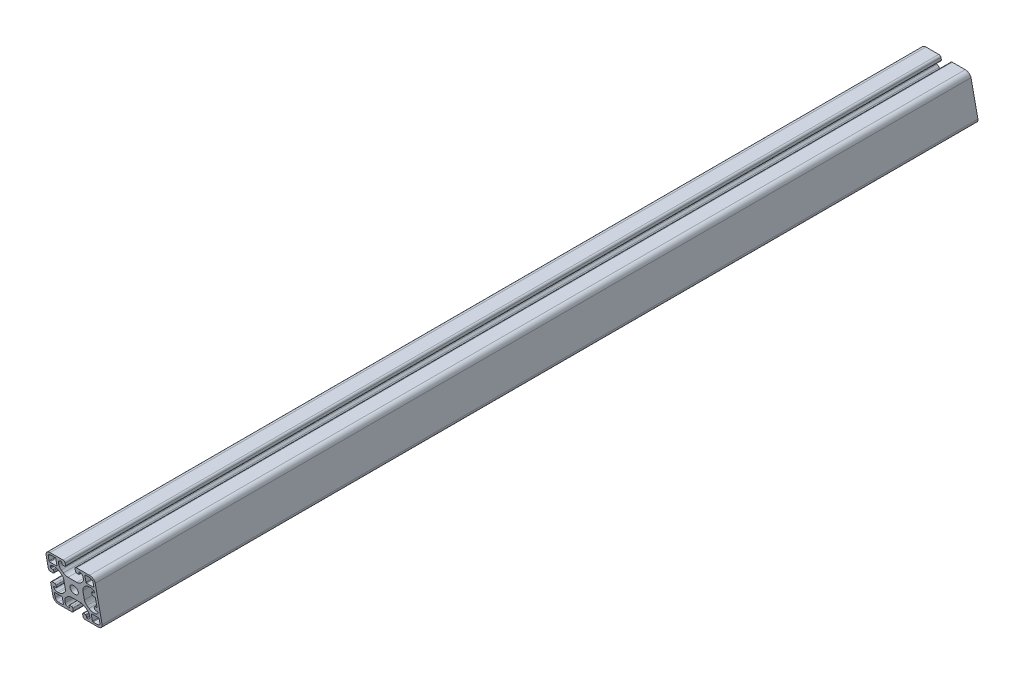
from build123d import *

# Parameters (mm, degrees)
SCHIZZO1_R                   = 3.4
ESTRUSIONE_ESTRUSIONE1_DEPTH = 720
TAGLIO_ESTRUSIONE1_DEPTH     = 383.622529394


with BuildPart() as part:
    # Schizzo1 → Estrusione-Estrusione1 (new body)
    with BuildSketch(Plane(origin=(0, 0, -340), x_dir=(-1, 0, 0), z_dir=(0, 0, -1))):
        with BuildLine():
            Line((6.5, -15.5), (5, -15.5))
            ThreePointArc((5, -15.5), (4.292893219, -15.792893219), (4, -16.5))
            Line((4, -16.5), (4, -18.5))
            ThreePointArc((4, -18.5), (4.439339828, -19.560660172), (5.5, -20))
            Line((5.5, -20), (16, -20))
            ThreePointArc((16, -20), (18.828427125, -18.828427125), (20, -16))
            Line((20, -16), (20, -5.5))
            ThreePointArc((20, -5.5), (19.560660172, -4.439339828), (18.5, -4))
            Line((18.5, -4), (16.5, -4))
            ThreePointArc((16.5, -4), (15.792893219, -4.292893219), (15.5, -5))
            Line((15.5, -5), (15.5, -6.5))
            ThreePointArc((15.5, -6.5), (15.646446609, -6.853553391), (16, -7))
            Line((16, -7), (17.55, -7))
            ThreePointArc((17.55, -7), (17.868198052, -7.131801948), (18, -7.45))
            Line((18, -7.45), (18, -7.5))
            ThreePointArc((18, -7.5), (17.267766953, -9.267766953), (15.5, -10))
            Line((15.5, -10), (14.192388155, -10))
            ThreePointArc((14.192388155, -10), (12.278970994, -9.619397663), (10.656854249, -8.535533906))
            Line((10.656854249, -8.535533906), (9.214466094, -7.09314575))
            ThreePointArc((9.214466094, -7.09314575), (8.130602337, -5.471029006), (7.75, -3.557611845))
            Line((7.75, -3.557611845), (7.75, 3.557611845))
            ThreePointArc((7.75, 3.557611845), (8.130602337, 5.471029006), (9.214466094, 7.09314575))
            Line((9.214466094, 7.09314575), (10.656854249, 8.535533906))
            ThreePointArc((10.656854249, 8.535533906), (12.278970994, 9.619397663), (14.192388155, 10))
            Line((14.192388155, 10), (15.5, 10))
            ThreePointArc((15.5, 10), (17.267766953, 9.267766953), (18, 7.5))
            Line((18, 7.5), (18, 7.45))
            ThreePointArc((18, 7.45), (17.868198052, 7.131801948), (17.55, 7))
            Line((17.55, 7), (16, 7))
            ThreePointArc((16, 7), (15.646446609, 6.853553391), (15.5, 6.5))
            Line((15.5, 6.5), (15.5, 5))
            ThreePointArc((15.5, 5), (15.792893219, 4.292893219), (16.5, 4))
            Line((16.5, 4), (18.5, 4))
            ThreePointArc((18.5, 4), (19.560660172, 4.439339828), (20, 5.5))
            Line((20, 5.5), (20, 16))
            ThreePointArc((20, 16), (18.828427125, 18.828427125), (16, 20))
            Line((16, 20), (5.5, 20))
            ThreePointArc((5.5, 20), (4.439339828, 19.560660172), (4, 18.5))
            Line((4, 18.5), (4, 16.5))
            ThreePointArc((4, 16.5), (4.292893219, 15.792893219), (5, 15.5))
            Line((5, 15.5), (6.5, 15.5))
            ThreePointArc((6.5, 15.5), (6.853553391, 15.646446609), (7, 16))
            Line((7, 16), (7, 17.55))
            ThreePointArc((7, 17.55), (7.131801948, 17.868198052), (7.45, 18))
            Line((7.45, 18), (7.5, 18))
            ThreePointArc((7.5, 18), (9.267766953, 17.267766953), (10, 15.5))
            Line((10, 15.5), (10, 14.192388155))
            ThreePointArc((10, 14.192388155), (9.619397663, 12.278970994), (8.535533906, 10.656854249))
            Line((8.535533906, 10.656854249), (7.09314575, 9.214466094))
            ThreePointArc((7.09314575, 9.214466094), (5.471029006, 8.130602337), (3.557611844, 7.75))
            Line((3.557611844, 7.75), (-3.557611845, 7.75))
            ThreePointArc((-3.557611845, 7.75), (-5.471029006, 8.130602337), (-7.09314575, 9.214466094))
            Line((-7.09314575, 9.214466094), (-8.535533906, 10.656854249))
            ThreePointArc((-8.535533906, 10.656854249), (-9.619397663, 12.278970994), (-10, 14.192388155))
            Line((-10, 14.192388155), (-10, 15.5))
            ThreePointArc((-10, 15.5), (-9.267766953, 17.267766953), (-7.5, 18))
            Line((-7.5, 18), (-7.45, 18))
            ThreePointArc((-7.45, 18), (-7.131801948, 17.868198052), (-7, 17.55))
            Line((-7, 17.55), (-7, 16))
            ThreePointArc((-7, 16), (-6.853553391, 15.646446609), (-6.5, 15.5))
            Line((-6.5, 15.5), (-5, 15.5))
            ThreePointArc((-5, 15.5), (-4.292893219, 15.792893219), (-4, 16.5))
            Line((-4, 16.5), (-4, 18.5))
            ThreePointArc((-4, 18.5), (-4.439339828, 19.560660172), (-5.5, 20))
            Line((-5.5, 20), (-16, 20))
            ThreePointArc((-16, 20), (-18.828427125, 18.828427125), (-20, 16))
            Line((-20, 16), (-20, -16))
            ThreePointArc((-20, -16), (-18.828427125, -18.828427125), (-16, -20))
            Line((-16, -20), (-5.5, -20))
            ThreePointArc((-5.5, -20), (-4.439339828, -19.560660172), (-4, -18.5))
            Line((-4, -18.5), (-4, -16.5))
            ThreePointArc((-4, -16.5), (-4.292893219, -15.792893219), (-5, -15.5))
            Line((-5, -15.5), (-6.5, -15.5))
            ThreePointArc((-6.5, -15.5), (-6.853553391, -15.646446609), (-7, -16))
            Line((-7, -16), (-7, -17.55))
            ThreePointArc((-7, -17.55), (-7.131801948, -17.868198052), (-7.45, -18))
            Line((-7.45, -18), (-7.5, -18))
            ThreePointArc((-7.5, -18), (-9.267766953, -17.267766953), (-10, -15.5))
            Line((-10, -15.5), (-10, -14.192388155))
            ThreePointArc((-10, -14.192388155), (-9.619397663, -12.278970994), (-8.535533906, -10.656854249))
            Line((-8.535533906, -10.656854249), (-7.09314575, -9.214466094))
            ThreePointArc((-7.09314575, -9.214466094), (-5.471029006, -8.130602337), (-3.557611845, -7.75))
            Line((-3.557611845, -7.75), (3.557611845, -7.75))
            ThreePointArc((3.557611845, -7.75), (5.471029006, -8.130602337), (7.09314575, -9.214466094))
            Line((7.09314575, -9.214466094), (8.535533906, -10.656854249))
            ThreePointArc((8.535533906, -10.656854249), (9.619397663, -12.278970994), (10, -14.192388155))
            Line((10, -14.192388155), (10, -15.5))
            ThreePointArc((10, -15.5), (9.267766953, -17.267766953), (7.5, -18))
            Line((7.5, -18), (7.45, -18))
            ThreePointArc((7.45, -18), (7.131801948, -17.868198052), (7, -17.55))
            Line((7, -17.55), (7, -16))
            ThreePointArc((7, -16), (6.853553391, -15.646446609), (6.5, -15.5))
        make_face()
        Circle(SCHIZZO1_R, mode=Mode.SUBTRACT)
        with BuildLine():
            Line((-12.3, -18.2), (-16, -18.2))
            ThreePointArc((-16, -18.2), (-17.555634919, -17.555634919), (-18.2, -16))
            Line((-18.2, -16), (-18.2, -12.3))
            ThreePointArc((-18.2, -12.3), (-18.053553391, -11.946446609), (-17.7, -11.8))
            Line((-17.7, -11.8), (-12.3, -11.8))
            ThreePointArc((-12.3, -11.8), (-11.946446609, -11.946446609), (-11.8, -12.3))
            Line((-11.8, -12.3), (-11.8, -17.7))
            ThreePointArc((-11.8, -17.7), (-11.946446609, -18.053553391), (-12.3, -18.2))
        make_face(mode=Mode.SUBTRACT)
        with BuildLine():
            Line((-11.8, 17.7), (-11.8, 12.3))
            ThreePointArc((-11.8, 12.3), (-11.946446609, 11.946446609), (-12.3, 11.8))
            Line((-12.3, 11.8), (-17.7, 11.8))
            ThreePointArc((-17.7, 11.8), (-18.053553391, 11.946446609), (-18.2, 12.3))
            Line((-18.2, 12.3), (-18.2, 16))
            ThreePointArc((-18.2, 16), (-17.555634919, 17.555634919), (-16, 18.2))
            Line((-16, 18.2), (-12.3, 18.2))
            ThreePointArc((-12.3, 18.2), (-11.946446609, 18.053553391), (-11.8, 17.7))
        make_face(mode=Mode.SUBTRACT)
        with BuildLine():
            Line((18.2, 16), (18.2, 12.3))
            ThreePointArc((18.2, 12.3), (18.053553391, 11.946446609), (17.7, 11.8))
            Line((17.7, 11.8), (12.3, 11.8))
            ThreePointArc((12.3, 11.8), (11.946446609, 11.946446609), (11.8, 12.3))
            Line((11.8, 12.3), (11.8, 17.7))
            ThreePointArc((11.8, 17.7), (11.946446609, 18.053553391), (12.3, 18.2))
            Line((12.3, 18.2), (16, 18.2))
            ThreePointArc((16, 18.2), (17.555634919, 17.555634919), (18.2, 16))
        make_face(mode=Mode.SUBTRACT)
        with BuildLine():
            Line((18.2, -12.3), (18.2, -16))
            ThreePointArc((18.2, -16), (17.555634919, -17.555634919), (16, -18.2))
            Line((16, -18.2), (12.3, -18.2))
            ThreePointArc((12.3, -18.2), (11.946446609, -18.053553391), (11.8, -17.7))
            Line((11.8, -17.7), (11.8, -12.3))
            ThreePointArc((11.8, -12.3), (11.946446609, -11.946446609), (12.3, -11.8))
            Line((12.3, -11.8), (17.7, -11.8))
            ThreePointArc((17.7, -11.8), (18.053553391, -11.946446609), (18.2, -12.3))
        make_face(mode=Mode.SUBTRACT)
        with BuildLine():
            Line((-16, 7), (-17.5, 7))
            ThreePointArc((-17.5, 7), (-17.853553391, 7.146446609), (-18, 7.5))
            ThreePointArc((-18, 7.5), (-17.267766953, 9.267766953), (-15.5, 10))
            Line((-15.5, 10), (-14.192388155, 10))
            ThreePointArc((-14.192388155, 10), (-12.278970994, 9.619397663), (-10.656854249, 8.535533906))
            Line((-10.656854249, 8.535533906), (-9.214466094, 7.093145751))
            ThreePointArc((-9.214466094, 7.093145751), (-8.130602337, 5.471029006), (-7.75, 3.557611845))
            Line((-7.75, 3.557611845), (-7.75, -3.557611845))
            ThreePointArc((-7.75, -3.557611845), (-8.130602337, -5.471029006), (-9.214466094, -7.093145751))
            Line((-9.214466094, -7.093145751), (-10.656854249, -8.535533906))
            ThreePointArc((-10.656854249, -8.535533906), (-12.278970994, -9.619397663), (-14.192388155, -10))
            Line((-14.192388155, -10), (-15.5, -10))
            ThreePointArc((-15.5, -10), (-17.267766953, -9.267766953), (-18, -7.5))
            ThreePointArc((-18, -7.5), (-17.853553391, -7.146446609), (-17.5, -7))
            Line((-17.5, -7), (-16, -7))
            ThreePointArc((-16, -7), (-15.646446609, -6.853553391), (-15.5, -6.5))
            Line((-15.5, -6.5), (-15.5, -5))
            ThreePointArc((-15.5, -5), (-15.792893219, -4.292893219), (-16.5, -4))
            Line((-16.5, -4), (-17.5, -4))
            ThreePointArc((-17.5, -4), (-17.853553391, -3.853553391), (-18, -3.5))
            Line((-18, -3.5), (-18, 3.5))
            ThreePointArc((-18, 3.5), (-17.853553391, 3.853553391), (-17.5, 4))
            Line((-17.5, 4), (-16.5, 4))
            ThreePointArc((-16.5, 4), (-15.792893219, 4.292893219), (-15.5, 5))
            Line((-15.5, 5), (-15.5, 6.5))
            ThreePointArc((-15.5, 6.5), (-15.646446609, 6.853553391), (-16, 7))
        make_face(mode=Mode.SUBTRACT)
    extrude(amount=-ESTRUSIONE_ESTRUSIONE1_DEPTH)

    # Schizzo9 → Taglio-Estrusione1 (cut, through all)
    with BuildSketch(Plane(origin=(20, 0, 0), x_dir=(0, 0, -1), z_dir=(1, 0, 0))):
        Polygon((340, -20), (340, 20), (332.946920772, 20), align=None)
        Polygon((-380, -20), (-372.9433343, -20), (-380, 20), align=None)
    extrude(amount=-TAGLIO_ESTRUSIONE1_DEPTH, mode=Mode.SUBTRACT)


solid = part.part
